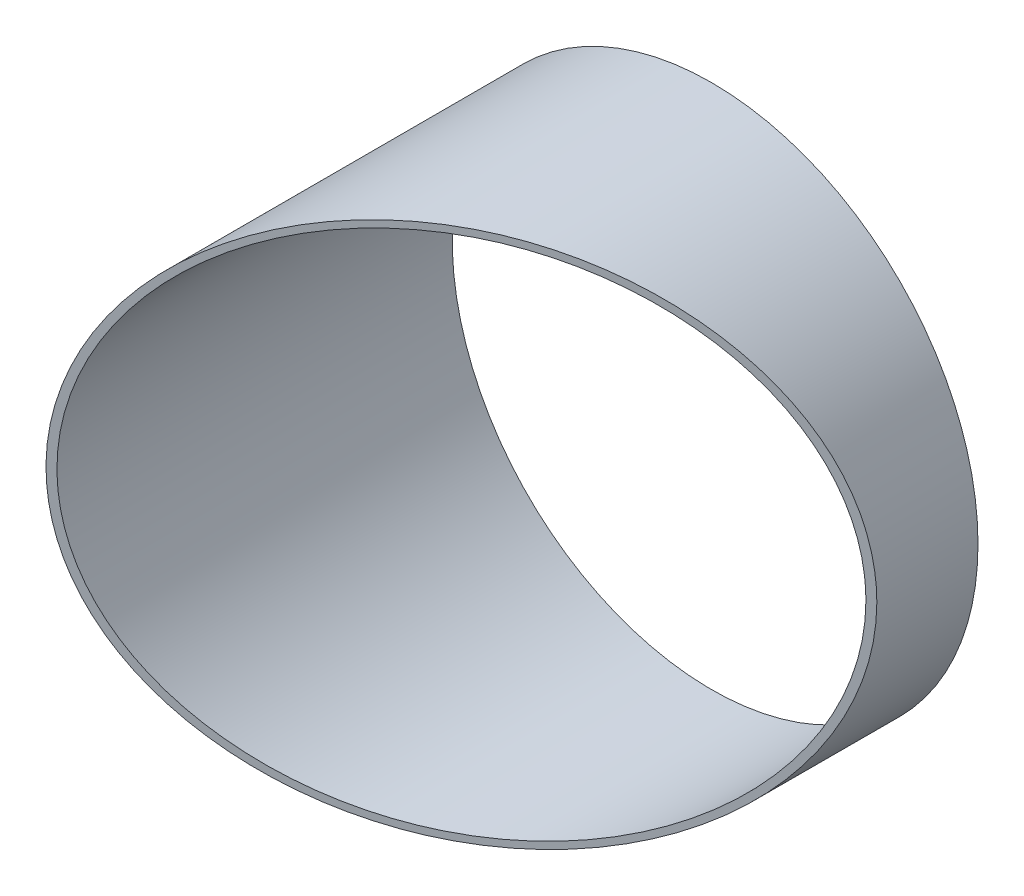
from build123d import *

# Parameters (mm, degrees)
SKETCH1_R               = 38
SKETCH1_R_2             = 37
BOSS_EXTRUDE1_DEPTH     = 100
CUT_EXTRUDE1_DEPTH      = 114.525327571
CUT_EXTRUDE1_DEPTH_BACK = 114.525327571


with BuildPart() as part:
    # Sketch1 → Boss-Extrude1 (new body)
    with BuildSketch(Plane.XY):
        Circle(SKETCH1_R)
        Circle(SKETCH1_R_2, mode=Mode.SUBTRACT)
    extrude(amount=BOSS_EXTRUDE1_DEPTH)

    # Sketch2 → Cut-Extrude1 (cut, two sides: drawn at the far end of the back side and taken through both)
    with BuildSketch(Plane(origin=(0, 0, 0), x_dir=(1, 0, 0), z_dir=(0, 1, 0)).offset(-CUT_EXTRUDE1_DEPTH_BACK)):
        Polygon((-38, -56.952837679), (-53.951830264, -56.952837679), (-53.951830264, -117.98330843), (80.738173953, -117.98330843), (80.738173953, -14.430441154), (38, -14.430441154), align=None)
    extrude(amount=CUT_EXTRUDE1_DEPTH + CUT_EXTRUDE1_DEPTH_BACK, mode=Mode.SUBTRACT)


solid = part.part
